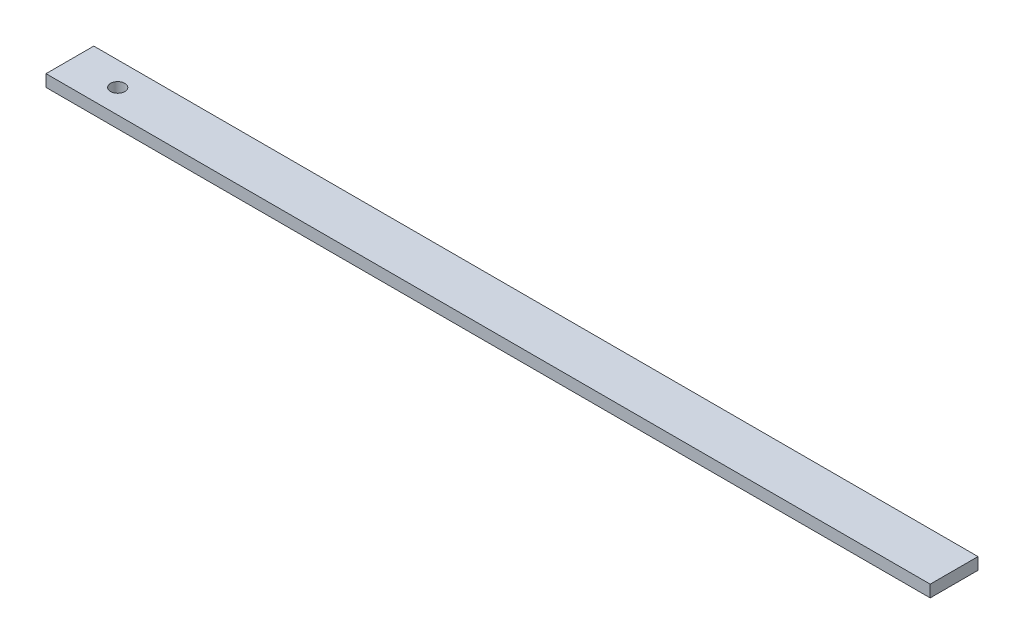
from build123d import *

# Parameters (mm, degrees)
SKETCH1_W             = 12.7
SKETCH1_H             = 3.175
BOSS_EXTRUDE1_DEPTH   = 234.95
F_6_CLEARANCE_HOLE1_D = 3.7973


with BuildPart() as part:
    # Sketch1 → Boss-Extrude1 (new body)
    with BuildSketch(Plane(origin=(0, 0, 0), x_dir=(0, 0, -1), z_dir=(1, 0, 0))):
        Rectangle(SKETCH1_W, SKETCH1_H)
    extrude(amount=-BOSS_EXTRUDE1_DEPTH)

    # #6 Clearance Hole1 (through all)
    with Locations(Plane(origin=(0, 1.5875, 0), x_dir=(1, 0, 0), z_dir=(0, 1, 0))):
        with Locations((-222.25, 0)):
            Hole(F_6_CLEARANCE_HOLE1_D / 2)


solid = part.part
